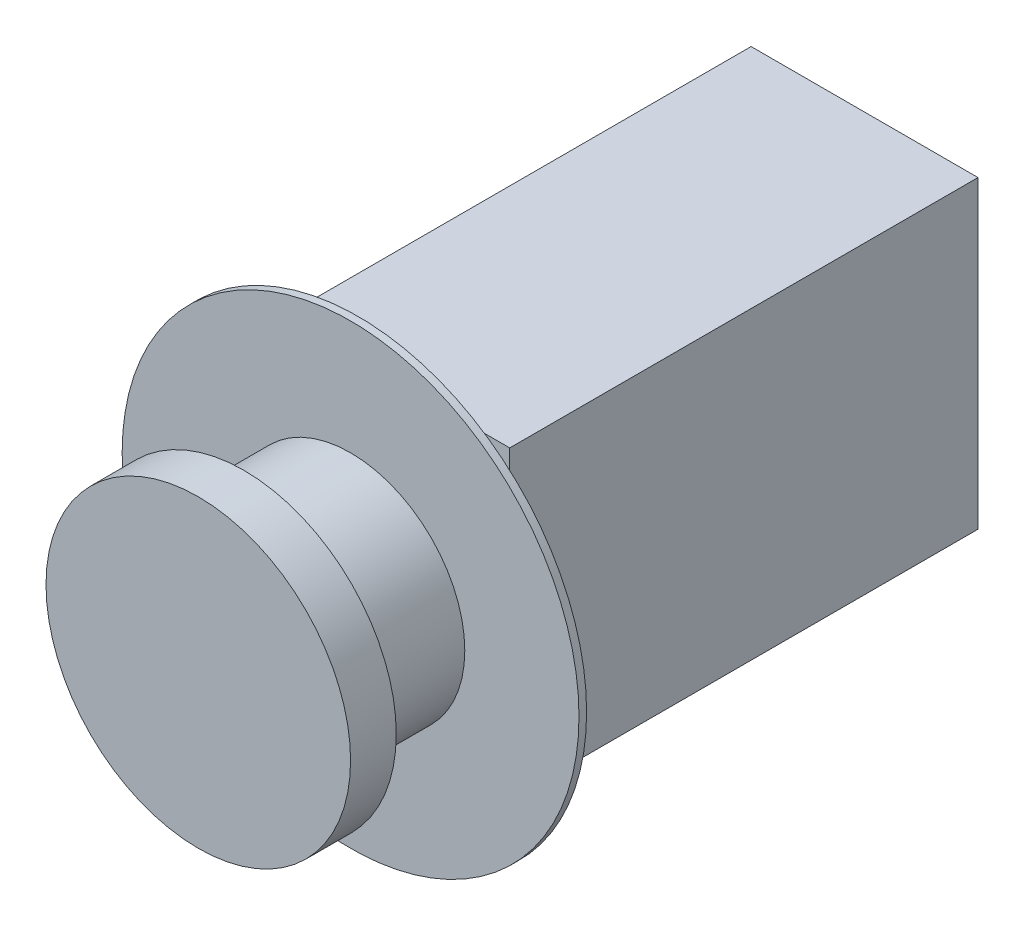
from build123d import *

# Parameters (mm, degrees)
SKETCH1_R           = 15
BOSS_EXTRUDE1_DEPTH = 15
SKETCH2_R           = 20
BOSS_EXTRUDE2_DEPTH = 6
SKETCH3_R           = 11
BOSS_EXTRUDE3_DEPTH = 15
BOSS_EXTRUDE4_START = 5
SKETCH4_W           = 29.8
SKETCH4_H           = 40
BOSS_EXTRUDE4_DEPTH = 61.5
SKETCH5_R           = 30
BOSS_EXTRUDE5_DEPTH = 1


with BuildPart() as part:
    # Sketch1 → Boss-Extrude1 (new body)
    with BuildSketch(Plane.XY):
        Circle(SKETCH1_R)
    extrude(amount=BOSS_EXTRUDE1_DEPTH)

    # Sketch2 → Boss-Extrude2 (add)
    with BuildSketch(Plane.XY.offset(15)):
        Circle(SKETCH2_R)
    extrude(amount=BOSS_EXTRUDE2_DEPTH)

    # Sketch3 → Boss-Extrude3 (add)
    with BuildSketch(Plane(origin=(0, 0, 0), x_dir=(-1, 0, 0), z_dir=(0, 0, -1))):
        with Locations(Location((0, 0, 0), (0, 0, 180))):
            Circle(SKETCH3_R)
    extrude(amount=BOSS_EXTRUDE3_DEPTH)

    # Sketch4 → Boss-Extrude4 (add)
    with BuildSketch(Plane(origin=(0, 0, 0), x_dir=(-1, 0, 0), z_dir=(0, 0, -1)).offset(BOSS_EXTRUDE4_START)):
        Rectangle(SKETCH4_W, SKETCH4_H)
    extrude(amount=BOSS_EXTRUDE4_DEPTH)

    # Sketch5 → Boss-Extrude5 (add)
    with BuildSketch(Plane(origin=(0, 0, 0), x_dir=(-1, 0, 0), z_dir=(0, 0, -1))):
        Circle(SKETCH5_R)
    extrude(amount=-BOSS_EXTRUDE5_DEPTH)


solid = part.part
